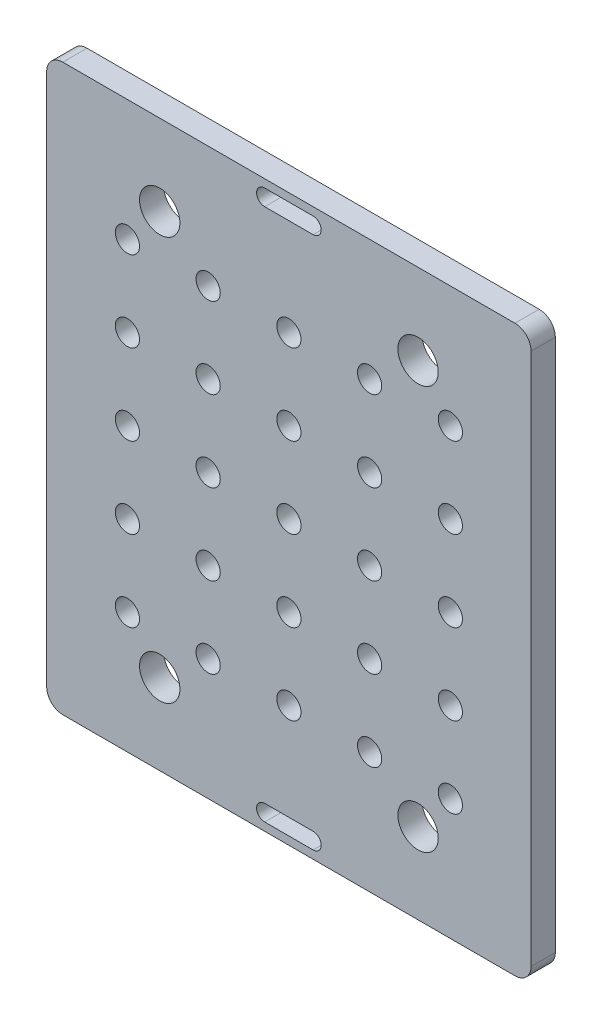
from build123d import *

# Parameters (mm, degrees)
MODEL_R             = 1.5
MODEL_R_2           = 2.5
BOSS_EXTRUDE1_DEPTH = 3


with BuildPart() as part:
    # Model → Boss-Extrude1 (new body)
    with BuildSketch(Plane.XY):
        with BuildLine():
            Line((-2, 70), (-58, 70))
            ThreePointArc((-58, 70), (-59.414213562, 69.414213562), (-60, 68))
            Line((-60, 68), (-60, 2))
            ThreePointArc((-60, 2), (-59.414213562, 0.585786438), (-58, 0))
            Line((-58, 0), (-2, 0))
            ThreePointArc((-2, 0), (-0.585786438, 0.585786438), (0, 2))
            Line((0, 2), (0, 68))
            ThreePointArc((0, 68), (-0.585786438, 69.414213562), (-2, 70))
        make_face()
        with Locations((-20, 45)):
            Circle(MODEL_R, mode=Mode.SUBTRACT)
        with Locations((-10, 35)):
            Circle(MODEL_R, mode=Mode.SUBTRACT)
        with Locations((-50, 45)):
            Circle(MODEL_R, mode=Mode.SUBTRACT)
        with Locations((-20, 15)):
            Circle(MODEL_R, mode=Mode.SUBTRACT)
        with Locations((-20, 35)):
            Circle(MODEL_R, mode=Mode.SUBTRACT)
        with Locations((-40, 25)):
            Circle(MODEL_R, mode=Mode.SUBTRACT)
        with Locations((-40, 15)):
            Circle(MODEL_R, mode=Mode.SUBTRACT)
        with Locations((-30, 25)):
            Circle(MODEL_R, mode=Mode.SUBTRACT)
        with Locations((-40, 55)):
            Circle(MODEL_R, mode=Mode.SUBTRACT)
        with Locations((-10, 25)):
            Circle(MODEL_R, mode=Mode.SUBTRACT)
        with Locations((-30, 45)):
            Circle(MODEL_R, mode=Mode.SUBTRACT)
        with Locations((-10, 55)):
            Circle(MODEL_R, mode=Mode.SUBTRACT)
        with Locations((-10, 45)):
            Circle(MODEL_R, mode=Mode.SUBTRACT)
        with Locations((-50, 15)):
            Circle(MODEL_R, mode=Mode.SUBTRACT)
        with Locations((-10, 15)):
            Circle(MODEL_R, mode=Mode.SUBTRACT)
        with Locations((-50, 35)):
            Circle(MODEL_R, mode=Mode.SUBTRACT)
        with Locations((-40, 45)):
            Circle(MODEL_R, mode=Mode.SUBTRACT)
        with Locations((-30, 15)):
            Circle(MODEL_R, mode=Mode.SUBTRACT)
        with Locations((-30, 35)):
            Circle(MODEL_R, mode=Mode.SUBTRACT)
        with Locations((-40, 35)):
            Circle(MODEL_R, mode=Mode.SUBTRACT)
        with Locations((-20, 25)):
            Circle(MODEL_R, mode=Mode.SUBTRACT)
        with Locations((-50, 25)):
            Circle(MODEL_R, mode=Mode.SUBTRACT)
        with Locations((-50, 55)):
            Circle(MODEL_R, mode=Mode.SUBTRACT)
        with Locations((-30, 55)):
            Circle(MODEL_R, mode=Mode.SUBTRACT)
        with Locations((-20, 55)):
            Circle(MODEL_R, mode=Mode.SUBTRACT)
        with Locations((-46, 60)):
            Circle(MODEL_R_2, mode=Mode.SUBTRACT)
        with Locations((-14, 10)):
            Circle(MODEL_R_2, mode=Mode.SUBTRACT)
        with Locations((-14, 60)):
            Circle(MODEL_R_2, mode=Mode.SUBTRACT)
        with Locations((-46, 10)):
            Circle(MODEL_R_2, mode=Mode.SUBTRACT)
        with BuildLine():
            Line((-27, 1), (-33, 1))
            ThreePointArc((-33, 1), (-34, 2), (-33, 3))
            Line((-33, 3), (-27, 3))
            ThreePointArc((-27, 3), (-26, 2), (-27, 1))
        make_face(mode=Mode.SUBTRACT)
        with BuildLine():
            Line((-33, 68.999828109), (-27, 68.999828109))
            ThreePointArc((-27, 68.999828109), (-26, 67.999828109), (-27, 66.999828109))
            Line((-27, 66.999828109), (-33, 66.999828109))
            ThreePointArc((-33, 66.999828109), (-34, 67.999828109), (-33, 68.999828109))
        make_face(mode=Mode.SUBTRACT)
    extrude(amount=BOSS_EXTRUDE1_DEPTH)


solid = part.part
